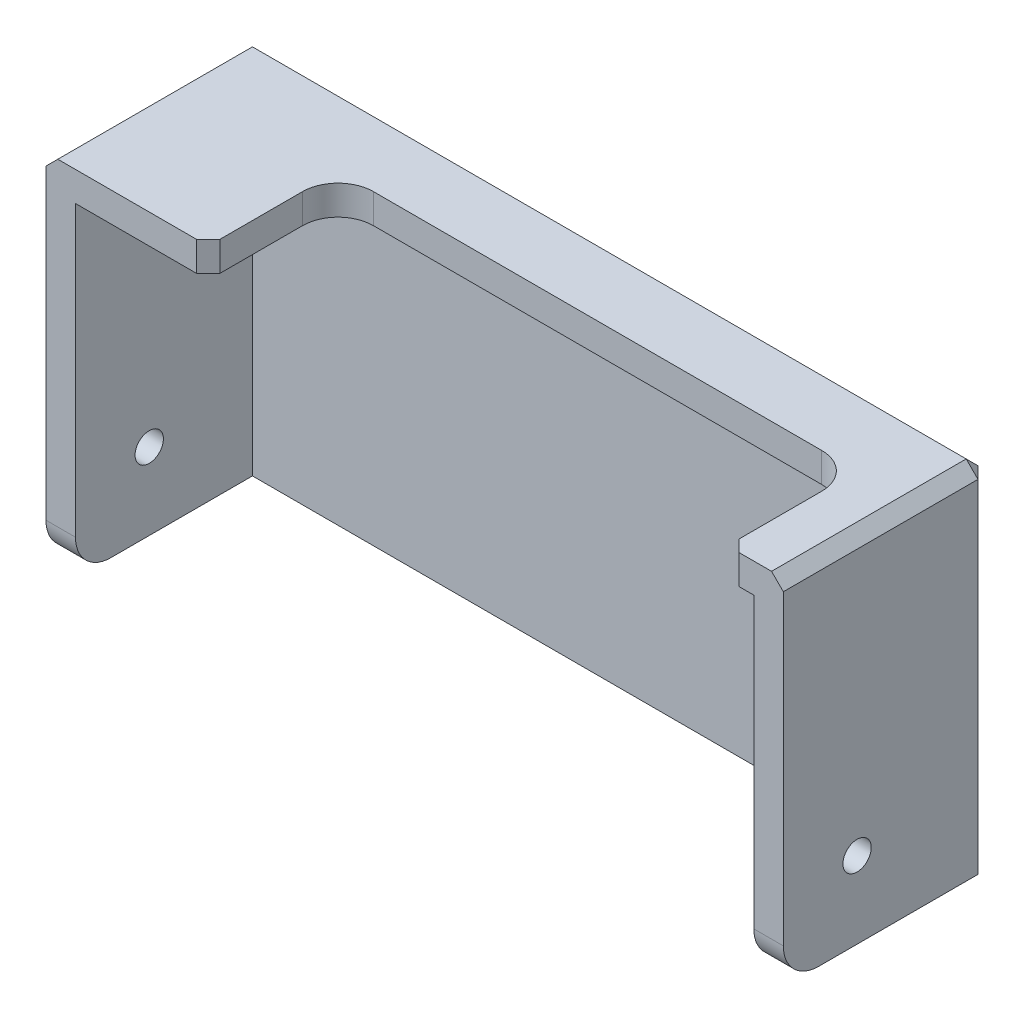
from build123d import *

# Parameters (mm, degrees)
SKETCH1_W            = 115
SKETCH1_H            = 55
BOSS_EXTRUDE1_DEPTH  = 30
SKETCH2_W            = 88
SKETCH2_H            = 22
CUT_EXTRUDE1_DEPTH   = 86.036756758
SHELL1_T             = 5
M4_CLEARANCE_HOLE1_D = 4.8
CHAMFER1_SIZE        = 2
FILLET1_R            = 6
FILLET2_R            = 6


with BuildPart() as part:
    # Sketch1 → Boss-Extrude1 (new body)
    with BuildSketch(Plane.XY):
        Rectangle(SKETCH1_W, SKETCH1_H)
    extrude(amount=BOSS_EXTRUDE1_DEPTH)

    # Sketch2 → Cut-Extrude1 (cut, through all)
    with BuildSketch(Plane(origin=(0, 27.5, 0), x_dir=(1, 0, 0), z_dir=(0, 1, 0))):
        with Locations((9, -19)):
            Rectangle(SKETCH2_W, SKETCH2_H)
    extrude(amount=-CUT_EXTRUDE1_DEPTH, mode=Mode.SUBTRACT)

    # Shell1
    shell1_openings = [part.faces().sort_by_distance(p)[0] for p in [
        (0, -27.5, 1.188486432),
        (55.25, 0, 30),
        (53, 0, 19),
        (9, 0, 8),
        (-35, 0, 19),
        (-46.25, 0, 30),
    ]]
    offset(amount=SHELL1_T, openings=shell1_openings, kind=Kind.INTERSECTION)

    # M4 Clearance Hole1 (through all)
    with Locations(Plane.ZY.offset(62.5)):
        with Locations((17.5, -14.5)):
            Hole(M4_CLEARANCE_HOLE1_D / 2)

    # Chamfer1
    chamfer1_edges = [part.edges().sort_by_distance(p)[0] for p in [
        (-35, 30, 30),
        (53, 30, 30),
        (0, -27.5, -5),
        (-62.5, 2.5, -5),
        (0, 32.5, -5),
        (62.5, 2.5, -5),
        (-62.5, 32.5, 12.5),
        (62.5, 32.5, 12.5),
    ]]
    chamfer(chamfer1_edges, length=CHAMFER1_SIZE)

    # Fillet1
    fillet1_edges = [part.edges().sort_by_distance(p)[0] for p in [
        (-35, 30, 8),
        (53, 30, 8),
    ]]
    fillet(fillet1_edges, radius=FILLET1_R)

    # Fillet2
    fillet2_edges = [part.edges().sort_by_distance(p)[0] for p in [
        (60, -27.5, 30),
        (-60, -27.5, 30),
    ]]
    fillet(fillet2_edges, radius=FILLET2_R)


solid = part.part
